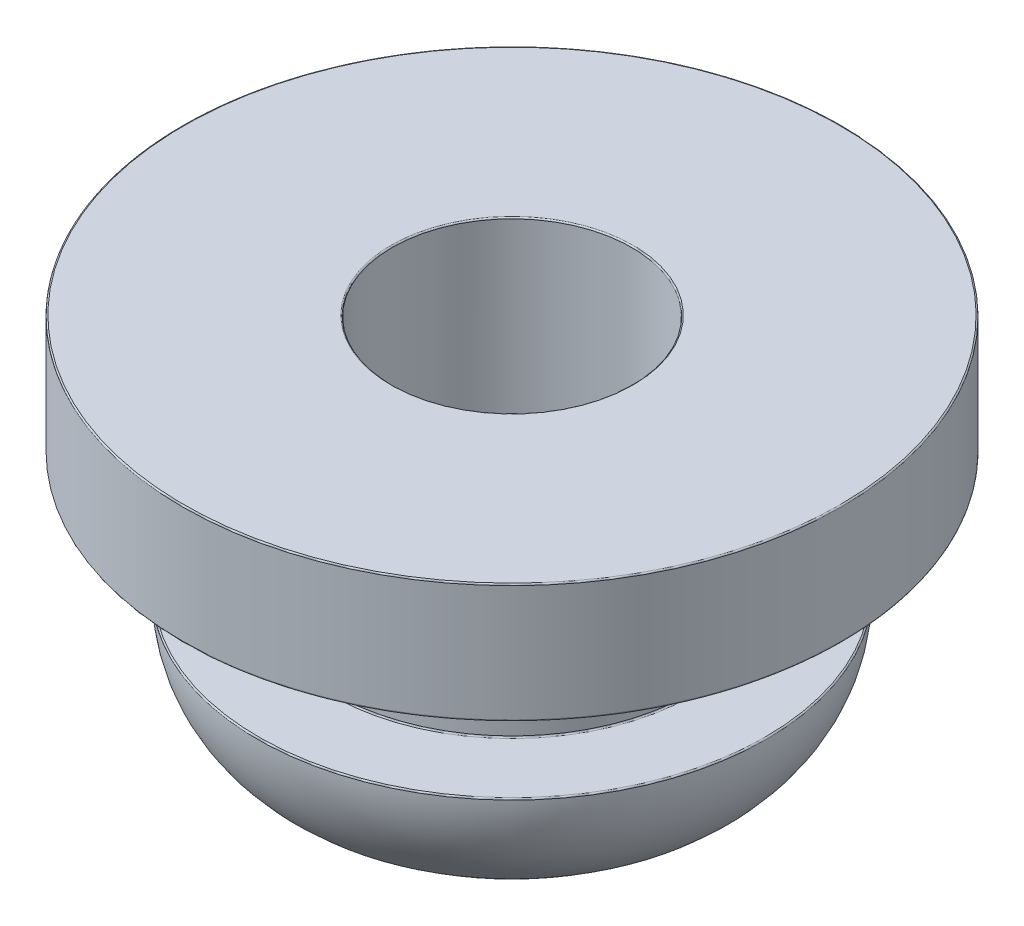
from build123d import *

# Parameters (mm, degrees)
FILLET1_R = 0.0174625


with BuildPart() as part:
    # Sketch2 → Revolve1 (revolve)
    with BuildSketch(Plane.XY, mode=Mode.PRIVATE) as revolve1_sk:
        with BuildLine():
            Line((2.38125, 0.79375), (2.38125, -0.79375))
            Line((2.38125, -0.79375), (3.3734375, -0.79375))
            ThreePointArc((3.3734375, -0.79375), (3.105262421, -1.73516862), (2.38125, -2.39395))
            Line((2.38125, -2.39395), (1.5875, -2.39395))
            Line((1.5875, -2.39395), (1.5875, 2.36855))
            Line((1.5875, 2.36855), (4.365625, 2.36855))
            Line((4.365625, 2.36855), (4.365625, 0.79375))
            Line((4.365625, 0.79375), (2.38125, 0.79375))
        make_face()
    revolve(revolve1_sk.sketch.rotate(Axis((0, 2.36855, 0), (0, -1, 0)), 180), axis=Axis((0, 2.36855, 0), (0, -1, 0)))

    # Fillet1
    fillet1_edges = [part.edges().sort_by_distance(p)[0] for p in [
        (2.38125, 0.79375, 0),
        (2.38125, -0.79375, 0),
        (3.3734375, -0.79375, 0),
        (2.38125, -2.39395, 0),
        (1.5875, -2.39395, 0),
        (1.5875, 2.36855, 0),
        (4.365625, 2.36855, 0),
        (4.365625, 0.79375, 0),
    ]]
    fillet(fillet1_edges, radius=FILLET1_R)


solid = part.part
